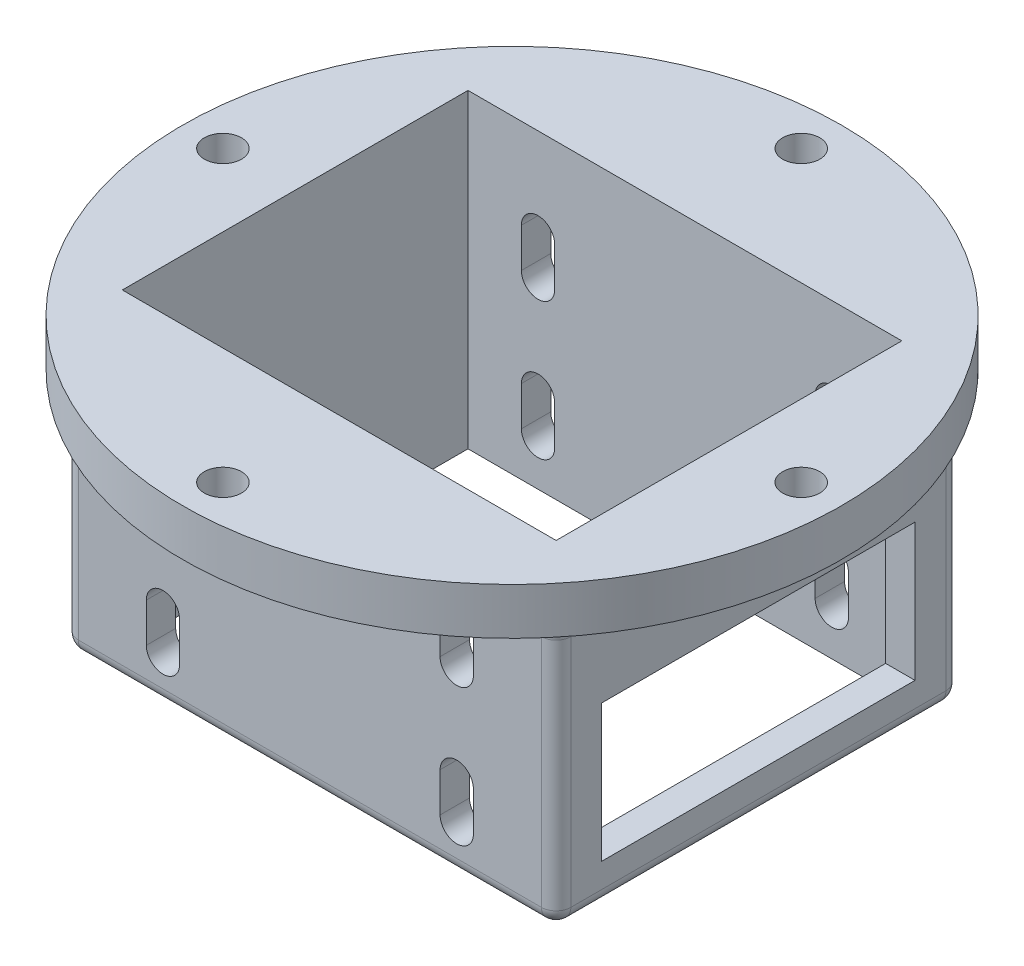
from build123d import *

# Parameters (mm, degrees)
SKETCH1_R             = 33.655
BOSS_EXTRUDE1_DEPTH   = 4.7625
SKETCH2_W             = 50.3
SKETCH2_H             = 41.3
BOSS_EXTRUDE2_DEPTH   = 31.7
F_6_CLEARANCE_HOLE1_D = 3.7973
SKETCH6_W             = 44.3
SKETCH6_H             = 35.3
CUT_EXTRUDE1_DEPTH    = 28.7
SKETCH7_W             = 32
SKETCH7_H             = 14
CUT_EXTRUDE2_DEPTH    = 3
FILLET1_R             = 1.5
CUT_EXTRUDE3_DEPTH    = 70.334846623
MIRROR2_COPY_1_DEPTH  = 70.334846623


with BuildPart() as part:
    # Sketch1 → Boss-Extrude1 (new body)
    with BuildSketch(Plane(origin=(0, 0, 0), x_dir=(1, 0, 0), z_dir=(0, 1, 0))):
        with Locations(Location((0, 0, 0), (0, 0, 90))):
            Circle(SKETCH1_R)
    extrude(amount=BOSS_EXTRUDE1_DEPTH)

    # Sketch2 → Boss-Extrude2 (add)
    with BuildSketch(Plane(origin=(0, 4.7625, 0), x_dir=(1, 0, 0), z_dir=(0, 1, 0))):
        Rectangle(SKETCH2_W, SKETCH2_H)
    extrude(amount=-BOSS_EXTRUDE2_DEPTH)

    # #6 Clearance Hole1 (through all)
    with Locations(Plane(origin=(0, 4.7625, 0), x_dir=(1, 0, 0), z_dir=(0, 1, 0))):
        with Locations((0, 29.5275), (29.5275, 0), (0, -29.5275), (-29.5275, 0)):
            Hole(F_6_CLEARANCE_HOLE1_D / 2)

    # Sketch6 → Cut-Extrude1 (cut)
    with BuildSketch(Plane(origin=(0, 4.7625, 0), x_dir=(1, 0, 0), z_dir=(0, 1, 0))):
        Rectangle(SKETCH6_W, SKETCH6_H)
    cut_extrude1 = extrude(amount=-CUT_EXTRUDE1_DEPTH, mode=Mode.SUBTRACT)

    # Sketch7 → Cut-Extrude2 (cut)
    with BuildSketch(Plane(origin=(25.15, 0, 0), x_dir=(0, 0, -1), z_dir=(1, 0, 0))):
        with Locations((0, -15.9375)):
            Rectangle(SKETCH7_W, SKETCH7_H)
    extrude(amount=-CUT_EXTRUDE2_DEPTH, mode=Mode.SUBTRACT)

    # Fillet1
    fillet1_edges = [part.edges().sort_by_distance(p)[0] for p in [
        (25.15, -13.46875, 20.65),
        (-25.15, -26.9375, 0),
        (-25.15, -13.46875, 20.65),
        (0, -26.9375, -20.65),
        (-25.15, -13.46875, -20.65),
        (0, 0, -20.65),
        (-25.15, 0, 0),
        (0, 0, 20.65),
        (25.15, 0, 0),
        (25.15, -26.9375, 0),
        (25.15, -13.46875, -20.65),
        (0, -26.9375, 20.65),
    ]]
    fillet(fillet1_edges, radius=FILLET1_R)

    # Sketch14 → Cut-Extrude3 (cut, through all)
    with BuildSketch(Plane.XY.offset(-20.65)):
        with BuildLine():
            Line((13.3, -8.4375), (13.3, -4.4375))
            ThreePointArc((13.3, -4.4375), (15, -2.7375), (16.7, -4.4375))
            Line((16.7, -4.4375), (16.7, -8.4375))
            ThreePointArc((16.7, -8.4375), (15, -10.1375), (13.3, -8.4375))
        make_face()
    cut_extrude3 = extrude(amount=CUT_EXTRUDE3_DEPTH, mode=Mode.SUBTRACT)

    # Mirror1: Cut-Extrude3 across plane
    add(cut_extrude3.mirror(Plane(origin=(0, 0, 0), x_dir=(0, 0, 1), z_dir=(1, 0, 0))), mode=Mode.SUBTRACT)

    # Mirror2: Cut-Extrude1, Cut-Extrude3 across plane
    add(cut_extrude1.mirror(Plane.ZX.offset(-13.4375)), mode=Mode.SUBTRACT)
    add(cut_extrude3.mirror(Plane.ZX.offset(-13.4375)), mode=Mode.SUBTRACT)

    # Mirror2 copy 1 sketch → Mirror2 copy 1 (cut, through all)
    with BuildSketch(Plane(origin=(0, -26.875, -20.65), x_dir=(-1, 0, 0), z_dir=(0, 0, 1))):
        with BuildLine():
            Line((13.3, -8.4375), (13.3, -4.4375))
            ThreePointArc((13.3, -4.4375), (15, -2.7375), (16.7, -4.4375))
            Line((16.7, -4.4375), (16.7, -8.4375))
            ThreePointArc((16.7, -8.4375), (15, -10.1375), (13.3, -8.4375))
        make_face()
    extrude(amount=MIRROR2_COPY_1_DEPTH, mode=Mode.SUBTRACT)


solid = part.part
